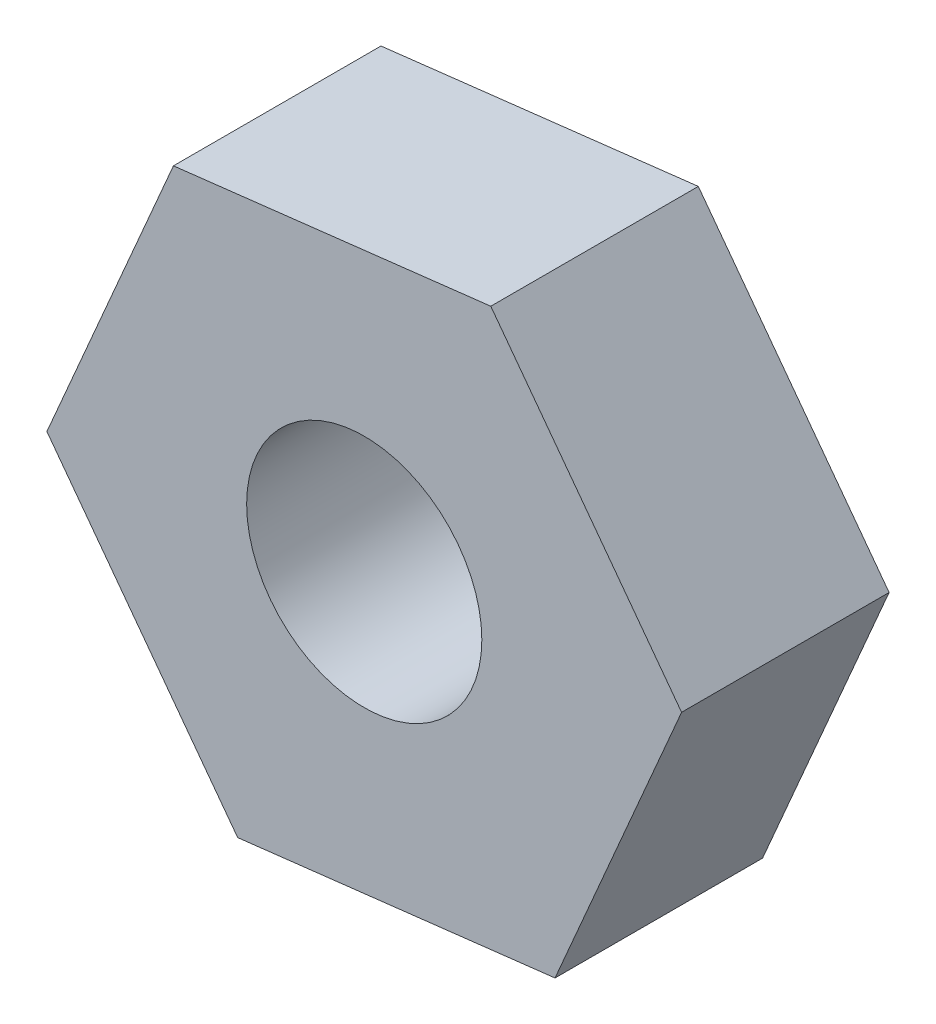
from build123d import *

# Parameters (mm, degrees)
SKETCH1_R           = 0.85
BOSS_EXTRUDE1_DEPTH = 1.5


with BuildPart() as part:
    # Sketch1 → Boss-Extrude1 (new body)
    with BuildSketch(Plane.XY):
        Polygon((1.379045355, -1.852448985), (2.293790558, 0.268063818), (0.914745202, 2.120512803), (-1.379045355, 1.852448985), (-2.293790558, -0.268063818), (-0.914745202, -2.120512803), align=None)
        Circle(SKETCH1_R, mode=Mode.SUBTRACT)
    extrude(amount=BOSS_EXTRUDE1_DEPTH)


solid = part.part
